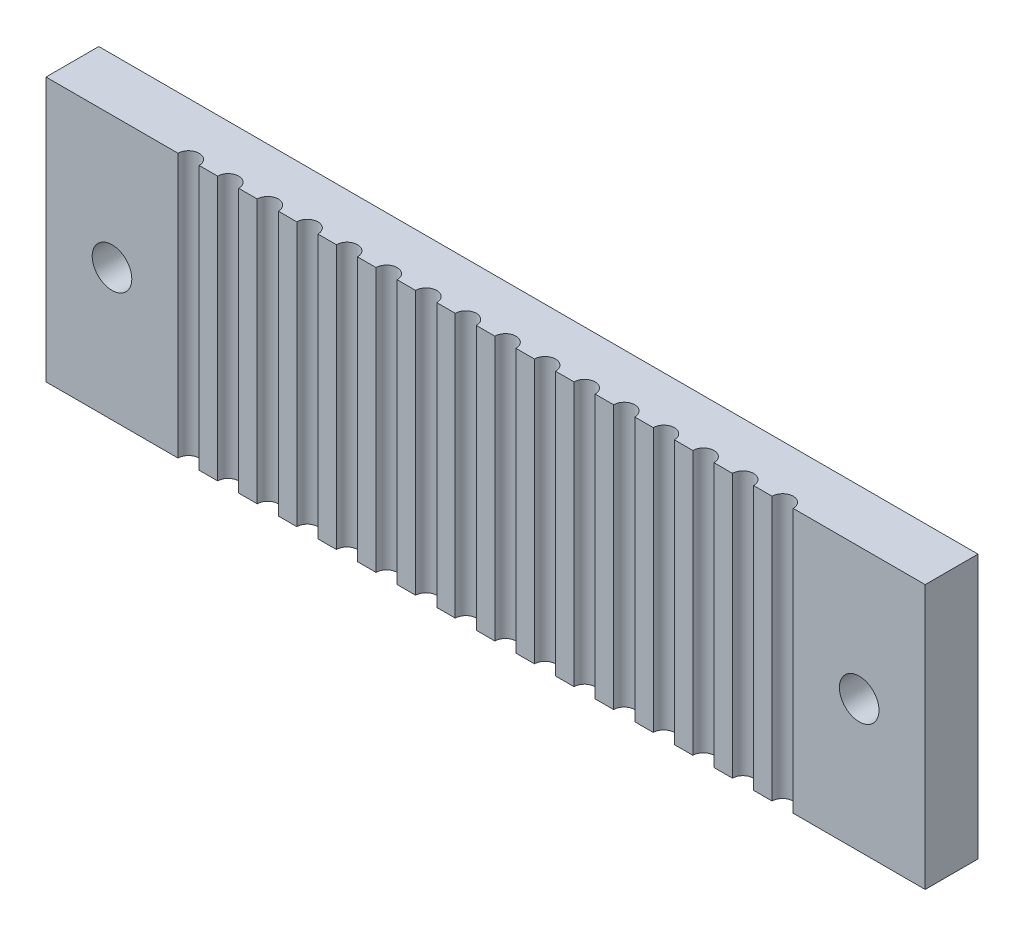
from build123d import *

# Parameters (mm, degrees)
EXTRUDE_1_DEPTH     = 20
SKETCH_2_R          = 1.5
CUT_EXTRUDE_1_DEPTH = 10


with BuildPart() as part:
    # 草图1 → 凸台-拉伸1 (new body)
    with BuildSketch(Plane(origin=(0, 0, 0), x_dir=(1, 0, 0), z_dir=(0, 1, 0))):
        with BuildLine():
            Line((-10.8, 0), (-0.8, 0))
            ThreePointArc((-0.8, 0), (0, 0.8), (0.8, 0))
            Line((0.8, 0), (2.2, 0))
            ThreePointArc((2.2, 0), (3, 0.8), (3.8, 0))
            Line((3.8, 0), (5.2, 0))
            ThreePointArc((5.2, 0), (6, 0.8), (6.8, 0))
            Line((6.8, 0), (8.2, 0))
            ThreePointArc((8.2, 0), (9, 0.8), (9.8, 0))
            Line((9.8, 0), (11.2, 0))
            ThreePointArc((11.2, 0), (12, 0.8), (12.8, 0))
            Line((12.8, 0), (14.2, 0))
            ThreePointArc((14.2, 0), (15, 0.8), (15.8, 0))
            Line((15.8, 0), (17.2, 0))
            ThreePointArc((17.2, 0), (18, 0.8), (18.8, 0))
            Line((18.8, 0), (20.2, 0))
            ThreePointArc((20.2, 0), (21, 0.8), (21.8, 0))
            Line((21.8, 0), (23.2, 0))
            ThreePointArc((23.2, 0), (24, 0.8), (24.8, 0))
            Line((24.8, 0), (26.2, 0))
            ThreePointArc((26.2, 0), (27, 0.8), (27.8, 0))
            Line((27.8, 0), (29.2, 0))
            ThreePointArc((29.2, 0), (30, 0.8), (30.8, 0))
            Line((30.8, 0), (32.2, 0))
            ThreePointArc((32.2, 0), (33, 0.8), (33.8, 0))
            Line((33.8, 0), (35.2, 0))
            ThreePointArc((35.2, 0), (36, 0.8), (36.8, 0))
            Line((36.8, 0), (38.2, 0))
            ThreePointArc((38.2, 0), (39, 0.8), (39.8, 0))
            Line((39.8, 0), (41.2, 0))
            ThreePointArc((41.2, 0), (42, 0.8), (42.8, 0))
            Line((42.8, 0), (44.2, 0))
            ThreePointArc((44.2, 0), (45, 0.8), (45.8, 0))
            Line((45.8, 0), (55.8, 0))
            Line((55.8, 0), (55.8, 4))
            Line((55.8, 4), (-10.8, 4))
            Line((-10.8, 4), (-10.8, 0))
        make_face()
    extrude(amount=EXTRUDE_1_DEPTH)

    # 草图2 → 切除-拉伸1 (cut)
    with BuildSketch(Plane.XY):
        with Locations((-5.8, 10)):
            Circle(SKETCH_2_R)
        with Locations((50.8, 10)):
            Circle(SKETCH_2_R)
    extrude(amount=-CUT_EXTRUDE_1_DEPTH, mode=Mode.SUBTRACT)


solid = part.part
